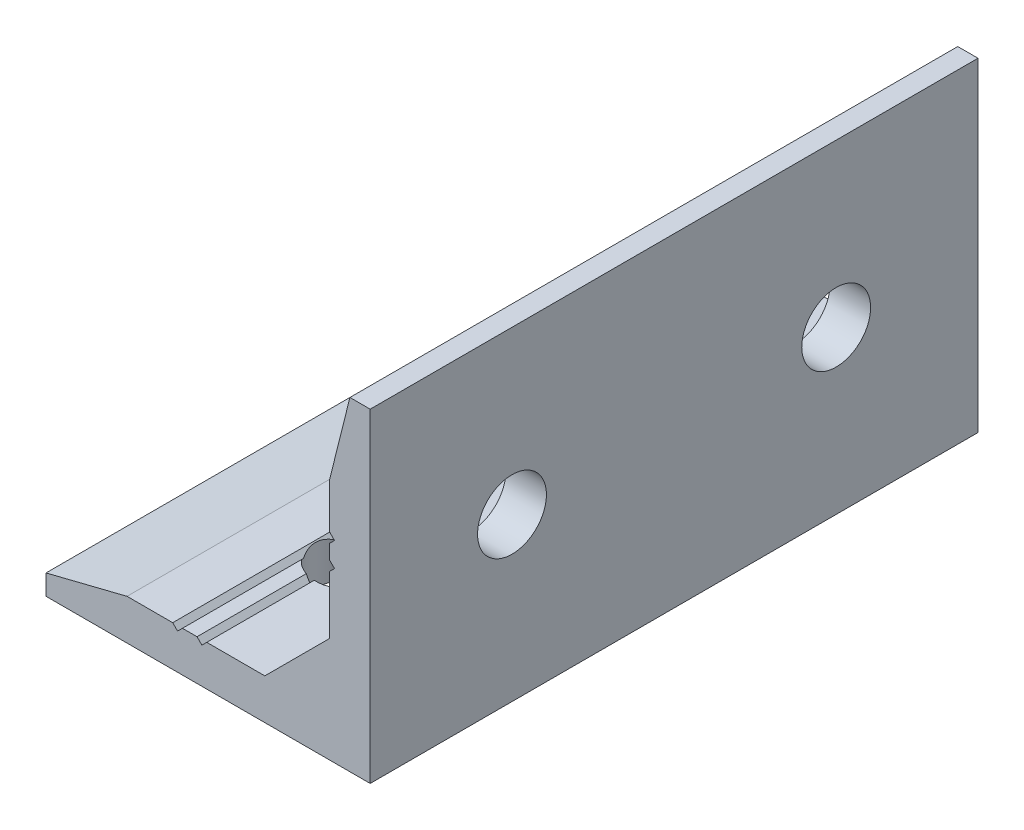
from build123d import *

# Parameters (mm, degrees)
EXTRUDE_1_DEPTH     = 37.5
SKETCH_3_R          = 4.25
CUT_EXTRUDE_1_DEPTH = 66.048059156


with BuildPart() as part:
    # 草图1 → 凸台-拉伸1 (new, symmetric)
    with BuildSketch(Plane.XY):
        Polygon((0, 0), (40, 0), (40, 40), (37.5, 40), (35, 30), (35, 24.364950833), (35.6, 23.764950833), (35, 23.164950833), (35, 21.364950833), (35.6, 20.764950833), (35, 20.164950833), (35, 13), (27, 5), (19.835049167, 5), (19.235049167, 4.4), (18.635049167, 5), (16.835049167, 5), (16.235049167, 4.4), (15.635049167, 5), (10, 5), (0, 2.5), align=None)
    extrude(amount=EXTRUDE_1_DEPTH, both=True)

    # 草图3 → 切除-拉伸1 (cut, through all)
    with BuildSketch(Plane(origin=(0, 5, 0), x_dir=(1, 0, 0), z_dir=(0, 1, 0))):
        with Locations(Location((20, 20, 0), (0, 0, 270))):
            Circle(SKETCH_3_R)
        with Locations(Location((20, -20, 0), (0, 0, 267.775679771))):
            Circle(SKETCH_3_R)
    cut_extrude_1 = extrude(amount=-CUT_EXTRUDE_1_DEPTH, mode=Mode.SUBTRACT)

    # 镜向1: 切除-拉伸1 across plane
    add(cut_extrude_1.mirror(Plane(origin=(20, 20, 0), x_dir=(0, 0, 1), z_dir=(0.7071067811865414, 0.7071067811865538, 0))), mode=Mode.SUBTRACT)


solid = part.part
